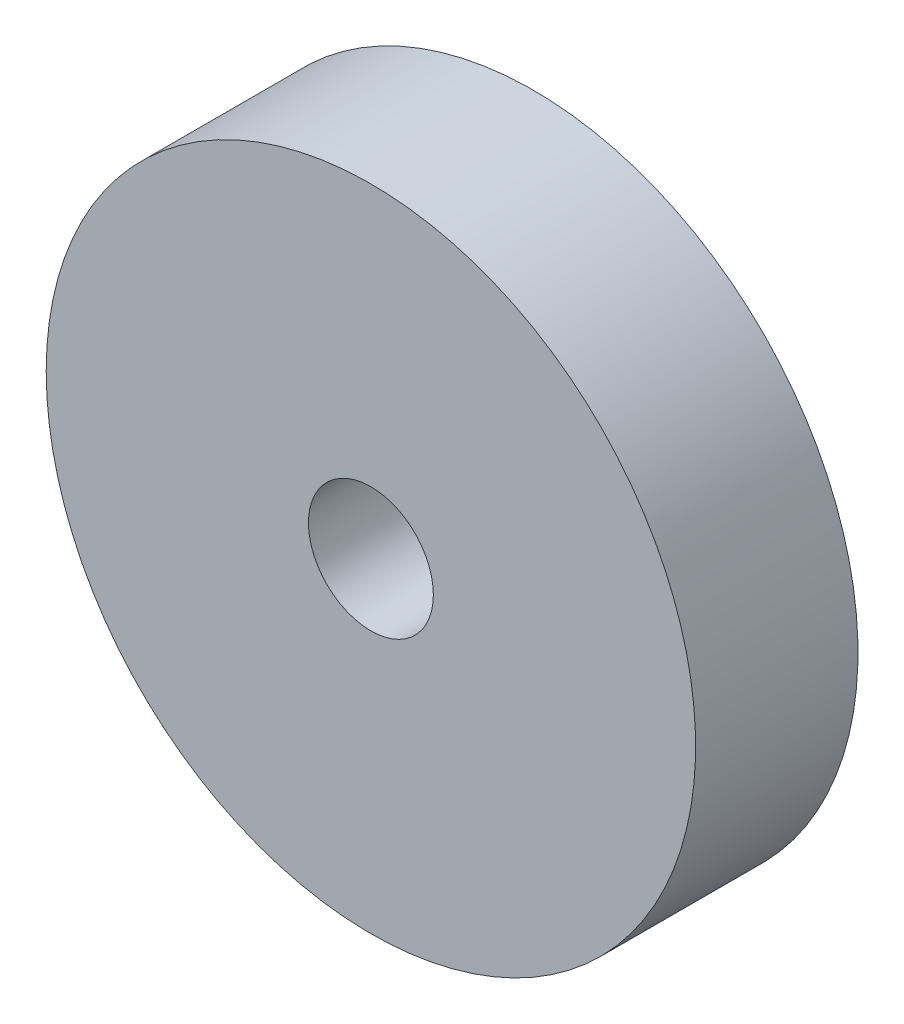
from build123d import *

# Parameters (mm, degrees)
SKETCH1_R           = 13
BOSS_EXTRUDE1_DEPTH = 6.5
CUT_EXTRUDE1_REACH  = 21.5
SKETCH2_R           = 2.5


with BuildPart() as part:
    # Sketch1 → Boss-Extrude1 (new body)
    with BuildSketch(Plane.XY):
        with Locations(Location((0, 0, 0), (0, 0, 180))):
            Circle(SKETCH1_R)
    extrude(amount=BOSS_EXTRUDE1_DEPTH)

    # Sketch2 → Cut-Extrude1 (cut, up to next)
    with BuildSketch(Plane.XY.offset(6.5), mode=Mode.PRIVATE) as cut_extrude1_sk1:
        Circle(SKETCH2_R)
    cut_extrude1_tool1 = extrude(cut_extrude1_sk1.sketch, amount=-CUT_EXTRUDE1_REACH, mode=Mode.PRIVATE) & part.part
    add(cut_extrude1_tool1.solids().sort_by_distance((0, 0, 6.5))[0], mode=Mode.SUBTRACT)


solid = part.part
